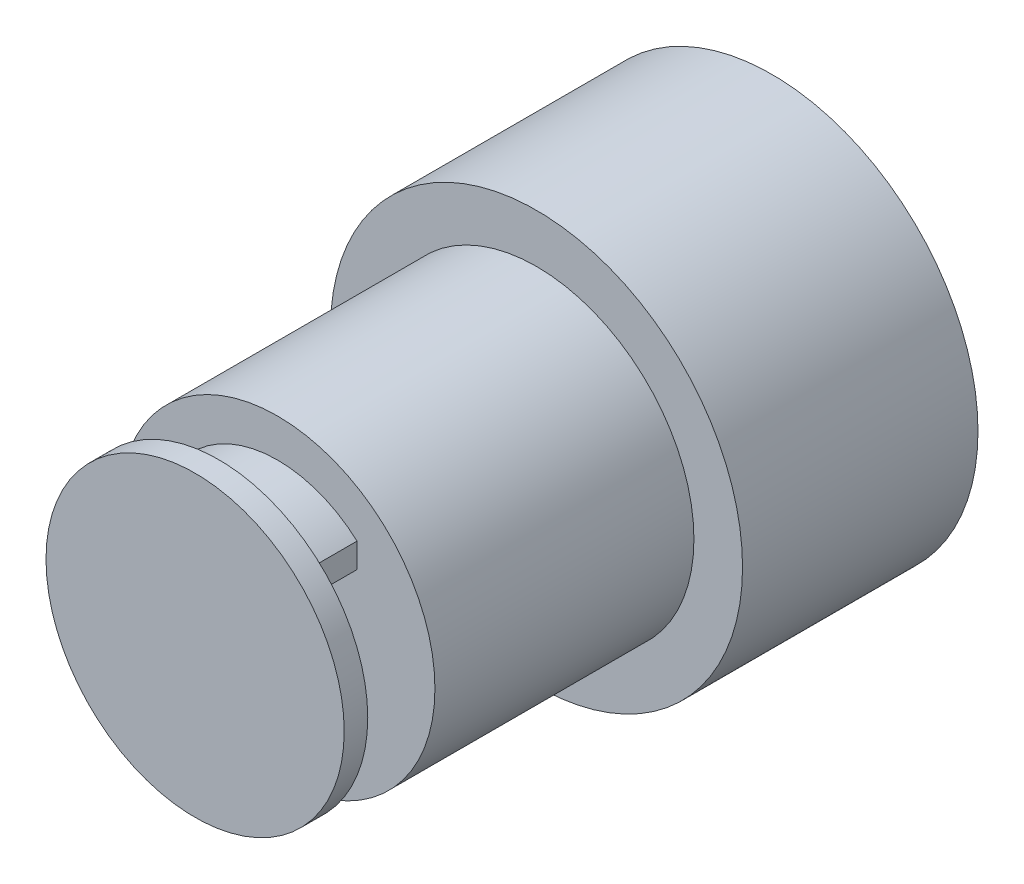
from build123d import *

# Parameters (mm, degrees)
SKETCH1_R           = 17.5
BOSS_EXTRUDE1_DEPTH = 20
SKETCH2_R           = 13.371126373
BOSS_EXTRUDE2_DEPTH = 22
BOSS_EXTRUDE3_DEPTH = 5
SKETCH4_R           = 12.665000137
BOSS_EXTRUDE4_DEPTH = 2
SKETCH5_R           = 2.5
BOSS_EXTRUDE5_DEPTH = 20
SKETCH6_R           = 6
SKETCH6_R_2         = 2.5
BOSS_EXTRUDE6_DEPTH = 4
CUT_EXTRUDE1_START  = -25
SKETCH8_R           = 2.5
CUT_EXTRUDE1_DEPTH  = 25


with BuildPart() as part:
    # Sketch1 → Boss-Extrude1 (new body)
    with BuildSketch(Plane.XY):
        Circle(SKETCH1_R)
    extrude(amount=BOSS_EXTRUDE1_DEPTH)

    # Sketch2 → Boss-Extrude2 (add)
    with BuildSketch(Plane.XY.offset(20)):
        Circle(SKETCH2_R)
    extrude(amount=BOSS_EXTRUDE2_DEPTH)

    # Sketch3 → Boss-Extrude3 (add)
    with BuildSketch(Plane.XY.offset(42)):
        with BuildLine():
            Line((-6.759376189, 7.547571999), (-6.759376189, 5.4522877))
            ThreePointArc((-6.759376189, 5.4522877), (0, 8.684273581), (6.759376189, 5.4522877))
            Line((6.759376189, 5.4522877), (6.759376189, 7.547571999))
            ThreePointArc((6.759376189, 7.547571999), (0, 10.131880849), (-6.759376189, 7.547571999))
        make_face()
        with BuildLine():
            Line((-6.759376189, -5.4522877), (-6.759376189, -7.547571999))
            ThreePointArc((-6.759376189, -7.547571999), (0, -10.131880849), (6.759376189, -7.547571999))
            Line((6.759376189, -7.547571999), (6.759376189, -5.4522877))
            ThreePointArc((6.759376189, -5.4522877), (0, -8.684273581), (-6.759376189, -5.4522877))
        make_face()
    extrude(amount=BOSS_EXTRUDE3_DEPTH)

    # Sketch4 → Boss-Extrude4 (add)
    with BuildSketch(Plane.XY.offset(47)):
        Circle(SKETCH4_R)
    extrude(amount=BOSS_EXTRUDE4_DEPTH)

    # Sketch5 → Boss-Extrude5 (add)
    with BuildSketch(Plane(origin=(0, 0, 0), x_dir=(-1, 0, 0), z_dir=(0, 0, -1))):
        with Locations(Location((0, -10, 0), (0, 0, 180))):
            Circle(SKETCH5_R)
    extrude(amount=BOSS_EXTRUDE5_DEPTH)

    # Sketch6 → Boss-Extrude6 (add)
    with BuildSketch(Plane(origin=(0, 0, 0), x_dir=(-1, 0, 0), z_dir=(0, 0, -1))):
        with Locations(Location((0, -10, 0), (0, 0, 180))):
            Circle(SKETCH6_R)
        with Locations((0, -10)):
            Circle(SKETCH6_R_2, mode=Mode.SUBTRACT)
    extrude(amount=BOSS_EXTRUDE6_DEPTH)

    # Sketch8 → Cut-Extrude1 (cut)
    with BuildSketch(Plane(origin=(0, 0, -20), x_dir=(-1, 0, 0), z_dir=(0, 0, -1)).offset(CUT_EXTRUDE1_START)):
        with Locations((0, -10)):
            Circle(SKETCH8_R)
    extrude(amount=CUT_EXTRUDE1_DEPTH, mode=Mode.SUBTRACT)


solid = part.part
